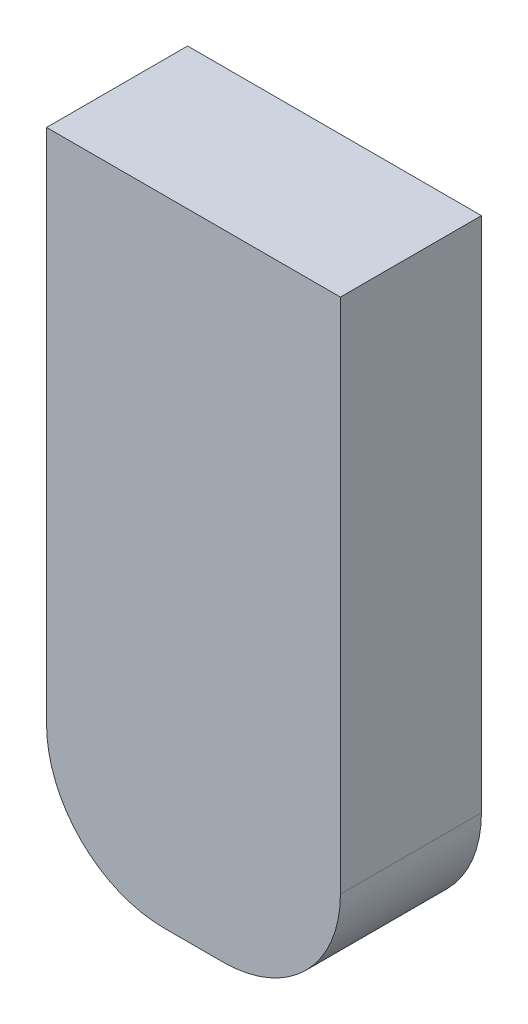
from build123d import *

# Parameters (mm, degrees)
SKETCH1_W           = 31.75
SKETCH1_H           = 68.58
BOSS_EXTRUDE1_DEPTH = 15.24
FILLET1_R           = 12.7


with BuildPart() as part:
    # Sketch1 → Boss-Extrude1 (new body)
    with BuildSketch(Plane.XY):
        with Locations((15.875, 34.29)):
            Rectangle(SKETCH1_W, SKETCH1_H)
    extrude(amount=BOSS_EXTRUDE1_DEPTH)

    # Fillet1
    fillet1_edges = [part.edges().sort_by_distance(p)[0] for p in [
        (31.75, 0, 7.62),
        (0, 0, 7.62),
    ]]
    fillet(fillet1_edges, radius=FILLET1_R)


solid = part.part
